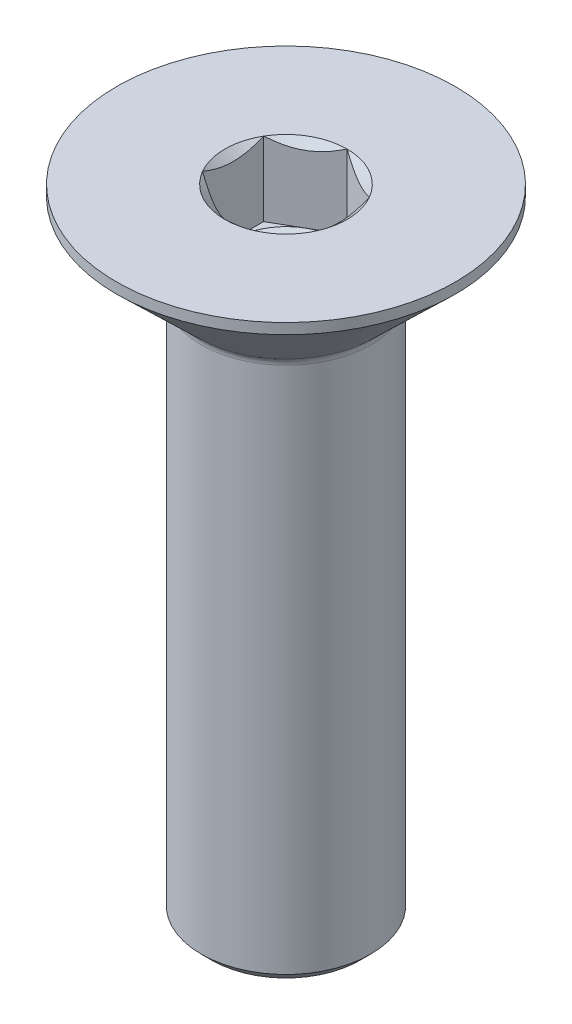
from build123d import *

# Parameters (mm, degrees)
CUT_EXTRUDE1_DEPTH = 3.5
FILLET1_R          = 0.5
CHAMFER1_SIZE      = 0.5


with BuildPart() as part:
    # Sketch1 → Revolve1 (revolve)
    with BuildSketch(Plane.XY, mode=Mode.PRIVATE) as revolve1_sk:
        Polygon((0, 0), (-8, 0), (-8, -0.5), (-4, -4.362755099), (-4, -30), (0, -30), align=None)
    revolve(revolve1_sk.sketch.rotate(Axis((0, 0, 0), (0, 1, 0)), 270), axis=Axis((0, 0, 0), (0, 1, 0)))

    # Sketch2 → Cut-Extrude1 (cut)
    with BuildSketch(Plane(origin=(0, 0, 0), x_dir=(1, 0, 0), z_dir=(0, 1, 0))):
        Polygon((0, 2.886751346), (-2.5, 1.443375673), (-2.5, -1.443375673), (0, -2.886751346), (2.5, -1.443375673), (2.5, 1.443375673), align=None)
    extrude(amount=-CUT_EXTRUDE1_DEPTH, mode=Mode.SUBTRACT)

    # Sketch3 → Cut-Revolve1 (revolve, cut)
    with BuildSketch(Plane.XY, mode=Mode.PRIVATE) as cut_revolve1_sk:
        Polygon((-2.5, -0.323053358), (-2.885, 0), (0, 0), (0, -4.409925586), (-2.5, -3.5), align=None)
    revolve(cut_revolve1_sk.sketch.rotate(Axis((0, -4.409925586, 0), (0, -1, 0)), 270), axis=Axis((0, -4.409925586, 0), (0, -1, 0)), mode=Mode.SUBTRACT)

    # Fillet1
    fillet1_edges = [part.edges().sort_by_distance(p)[0] for p in [
        (0, -4.362755099, 4),
    ]]
    fillet(fillet1_edges, radius=FILLET1_R)

    # Chamfer1
    chamfer1_edges = [part.edges().sort_by_distance(p)[0] for p in [
        (0, -30, 4),
    ]]
    chamfer(chamfer1_edges, length=CHAMFER1_SIZE)


solid = part.part
